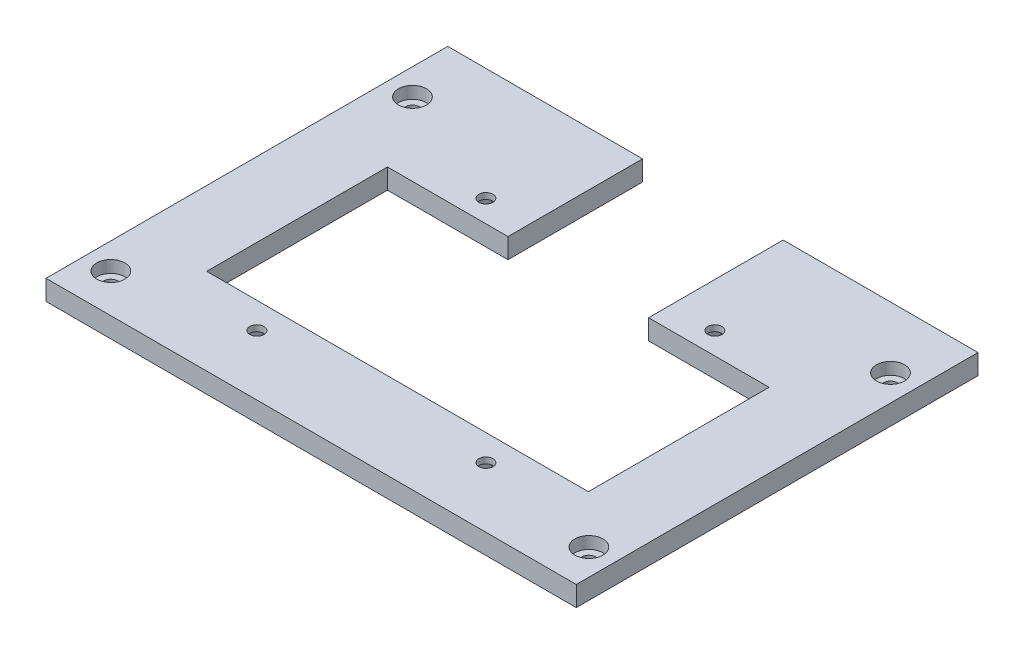
from build123d import *

# Parameters (mm, degrees)
SKETCH1_W           = 132
SKETCH1_H           = 100
BOSS_EXTRUDE1_DEPTH = 5
SKETCH2_R           = 1.75
CUT_EXTRUDE1_DEPTH  = 56
CUT_EXTRUDE4_DEPTH  = 103
SKETCH4_R           = 1.75
CUT_EXTRUDE5_DEPTH  = 103
SKETCH6_R           = 3.5
CUT_EXTRUDE6_DEPTH  = 3
CUT_EXTRUDE7_DEPTH  = 3.5


with BuildPart() as part:
    # Sketch1 → Boss-Extrude1 (new body)
    with BuildSketch(Plane(origin=(0, 0, 0), x_dir=(1, 0, 0), z_dir=(0, 1, 0))):
        Rectangle(SKETCH1_W, SKETCH1_H)
    extrude(amount=BOSS_EXTRUDE1_DEPTH)

    # Sketch2 → Cut-Extrude1 (cut)
    with BuildSketch(Plane(origin=(0, 5, 0), x_dir=(1, 0, 0), z_dir=(0, 1, 0))):
        with Locations(Location((-59.5, 34.72, 0), (0, 0, 270))):
            Circle(SKETCH2_R)
        with Locations(Location((-59.5, -40.36, 0), (0, 0, 270))):
            Circle(SKETCH2_R)
        with Locations(Location((59.5, -40.36, 0), (0, 0, 270))):
            Circle(SKETCH2_R)
        with Locations(Location((59.5, 34.72, 0), (0, 0, 270))):
            Circle(SKETCH2_R)
    extrude(amount=-CUT_EXTRUDE1_DEPTH, mode=Mode.SUBTRACT)

    # Sketch3 → Cut-Extrude4 (cut)
    with BuildSketch(Plane(origin=(0, 5, 0), x_dir=(1, 0, 0), z_dir=(0, 1, 0))):
        Polygon((-17.5, 50), (17.5, 50), (17.5, 16.5), (47.5, 16.5), (47.5, -28.5), (-47.5, -28.5), (-47.5, 16.5), (-17.5, 16.5), align=None)
    extrude(amount=-CUT_EXTRUDE4_DEPTH, mode=Mode.SUBTRACT)

    # Sketch4 → Cut-Extrude5 (cut)
    with BuildSketch(Plane(origin=(0, 5, 0), x_dir=(1, 0, 0), z_dir=(0, 1, 0))):
        with Locations(Location((-28.5, 22, 0), (0, 0, 270))):
            Circle(SKETCH4_R)
        with Locations(Location((-28.5, -35, 0), (0, 0, 270))):
            Circle(SKETCH4_R)
        with Locations(Location((28.5, -35, 0), (0, 0, 270))):
            Circle(SKETCH4_R)
        with Locations(Location((28.5, 22, 0), (0, 0, 270))):
            Circle(SKETCH4_R)
    extrude(amount=-CUT_EXTRUDE5_DEPTH, mode=Mode.SUBTRACT)

    # Sketch6 → Cut-Extrude6 (cut)
    with BuildSketch(Plane(origin=(0, 5, 0), x_dir=(1, 0, 0), z_dir=(0, 1, 0))):
        with Locations(Location((-59.5, 34.72, 0), (0, 0, 270))):
            Circle(SKETCH6_R)
        with Locations(Location((-59.5, -40.36, 0), (0, 0, 270))):
            Circle(SKETCH6_R)
        with Locations(Location((59.5, -40.36, 0), (0, 0, 270))):
            Circle(SKETCH6_R)
        with Locations(Location((59.5, 34.72, 0), (0, 0, 270))):
            Circle(SKETCH6_R)
    extrude(amount=-CUT_EXTRUDE6_DEPTH, mode=Mode.SUBTRACT)

    # Sketch7 → Cut-Extrude7 (cut)
    with BuildSketch(Plane.XZ):
        Polygon((26.479274058, -25.5), (30.520725942, -25.5), (32.541451884, -22), (30.520725942, -18.5), (26.479274058, -18.5), (24.458548116, -22), align=None)
        Polygon((24.458548116, 35), (26.479274058, 31.5), (30.520725942, 31.5), (32.541451884, 35), (30.520725942, 38.5), (26.479274058, 38.5), align=None)
        Polygon((-30.520725942, 38.5), (-32.541451884, 35), (-30.520725942, 31.5), (-26.479274058, 31.5), (-24.458548116, 35), (-26.479274058, 38.5), align=None)
        Polygon((-32.541451884, -22), (-30.520725942, -25.5), (-26.479274058, -25.5), (-24.458548116, -22), (-26.479274058, -18.5), (-30.520725942, -18.5), align=None)
    extrude(amount=-CUT_EXTRUDE7_DEPTH, mode=Mode.SUBTRACT)


solid = part.part
